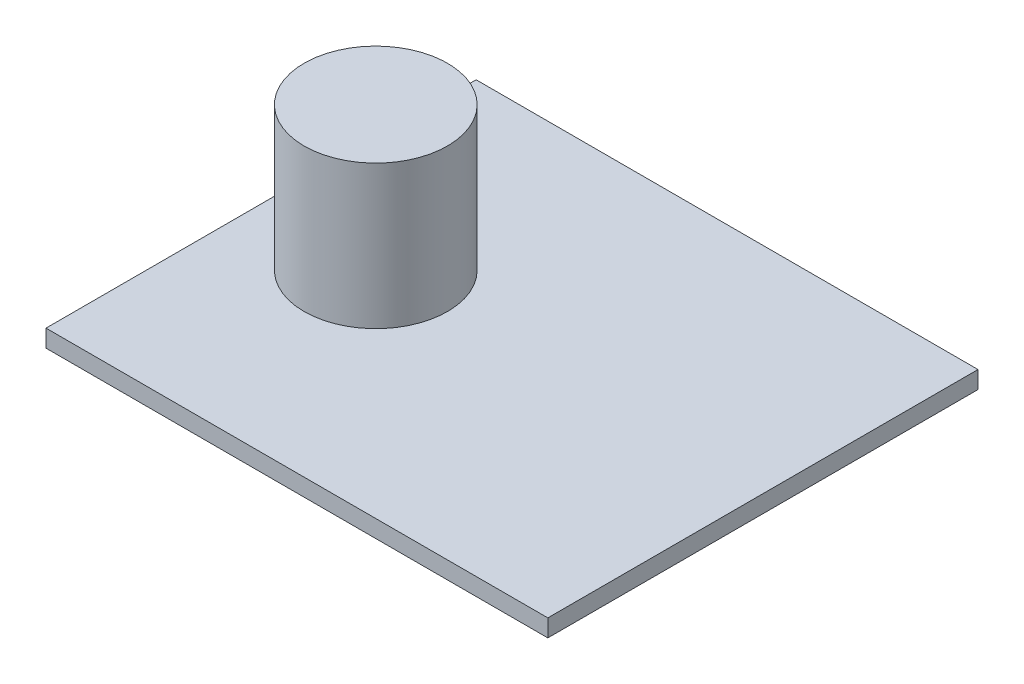
from build123d import *

# Parameters (mm, degrees)
SKETCH1_W           = 44.45
SKETCH1_H           = 38.1
BOSS_EXTRUDE1_DEPTH = 12.7
SKETCH4_W           = 44.45
SKETCH4_H           = 11.16076
CUT_EXTRUDE1_DEPTH  = 108.033044593
SKETCH5_R           = 6.35
BOSS_EXTRUDE2_DEPTH = 12.7


with BuildPart() as part:
    # Sketch1 → Boss-Extrude1 (new body)
    with BuildSketch(Plane(origin=(0, 0, 0), x_dir=(1, 0, 0), z_dir=(0, 1, 0))):
        with Locations((-76.987764476, 18.013859456)):
            Rectangle(SKETCH1_W, SKETCH1_H)
    extrude(amount=BOSS_EXTRUDE1_DEPTH)

    # Sketch4 → Cut-Extrude1 (cut, through all)
    with BuildSketch(Plane(origin=(0, 0, -37.063859456), x_dir=(-1, 0, 0), z_dir=(0, 0, -1))):
        with Locations((76.987764476, 7.11962)):
            Rectangle(SKETCH4_W, SKETCH4_H)
    extrude(amount=-CUT_EXTRUDE1_DEPTH, mode=Mode.SUBTRACT)

    # Sketch5 → Boss-Extrude2 (add)
    with BuildSketch(Plane(origin=(0, 1.53924, 0), x_dir=(1, 0, 0), z_dir=(0, 1, 0))):
        with Locations(Location((-89.052764476, 18.013859456, 0), (0, 0, 270))):
            Circle(SKETCH5_R)
    extrude(amount=BOSS_EXTRUDE2_DEPTH)


solid = part.part
